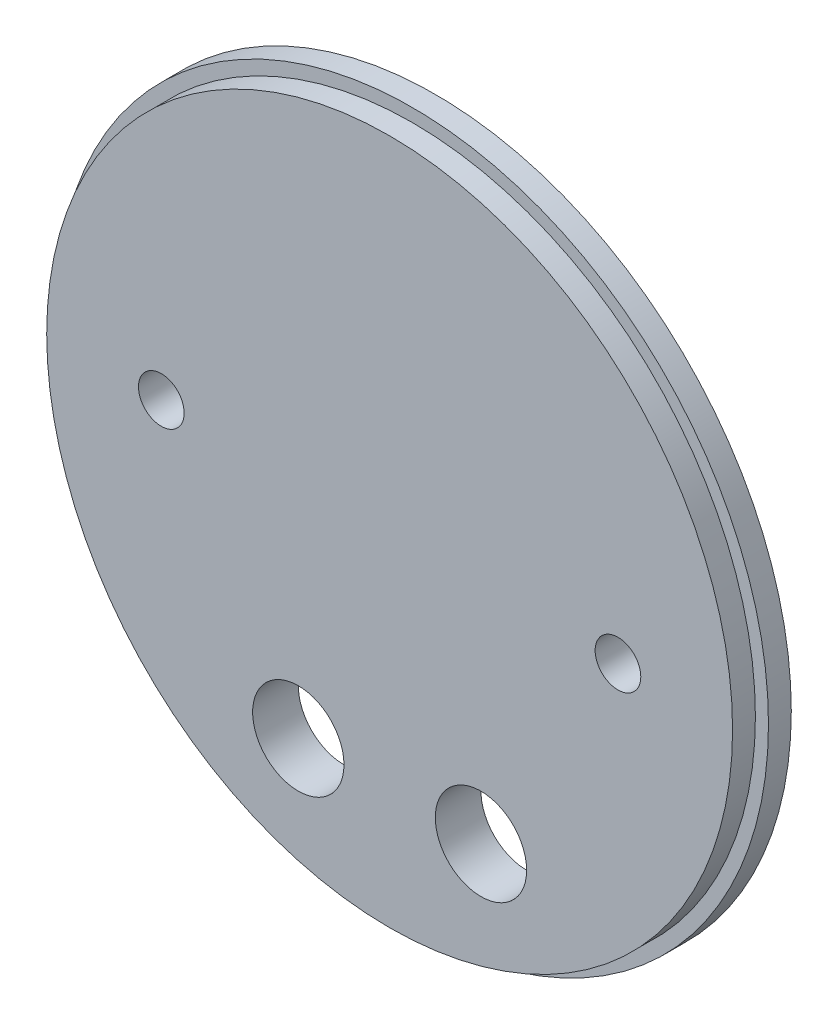
from build123d import *

# Parameters (mm, degrees)
SKETCH1_R           = 49.5046
BOSS_EXTRUDE1_DEPTH = 3.175
SKETCH2_R           = 47.6885
BOSS_EXTRUDE2_DEPTH = 3.175
SKETCH3_R           = 6.35
SKETCH3_R_2         = 3.175
CUT_EXTRUDE1_DEPTH  = 71.297463271


with BuildPart() as part:
    # Sketch1 → Boss-Extrude1 (new body)
    with BuildSketch(Plane.XY):
        Circle(SKETCH1_R)
    extrude(amount=BOSS_EXTRUDE1_DEPTH)

    # Sketch2 → Boss-Extrude2 (add)
    with BuildSketch(Plane.XY.offset(3.175)):
        Circle(SKETCH2_R)
    extrude(amount=BOSS_EXTRUDE2_DEPTH)

    # Sketch3 → Cut-Extrude1 (cut, through all)
    with BuildSketch(Plane.XY.offset(6.35)):
        with Locations((-12.7, -31.235352443)):
            Circle(SKETCH3_R)
        with Locations((12.7, -31.235352443)):
            Circle(SKETCH3_R)
        with Locations((-31.75, 0)):
            Circle(SKETCH3_R_2)
        with Locations((31.75, 0)):
            Circle(SKETCH3_R_2)
    extrude(amount=-CUT_EXTRUDE1_DEPTH, mode=Mode.SUBTRACT)


solid = part.part
